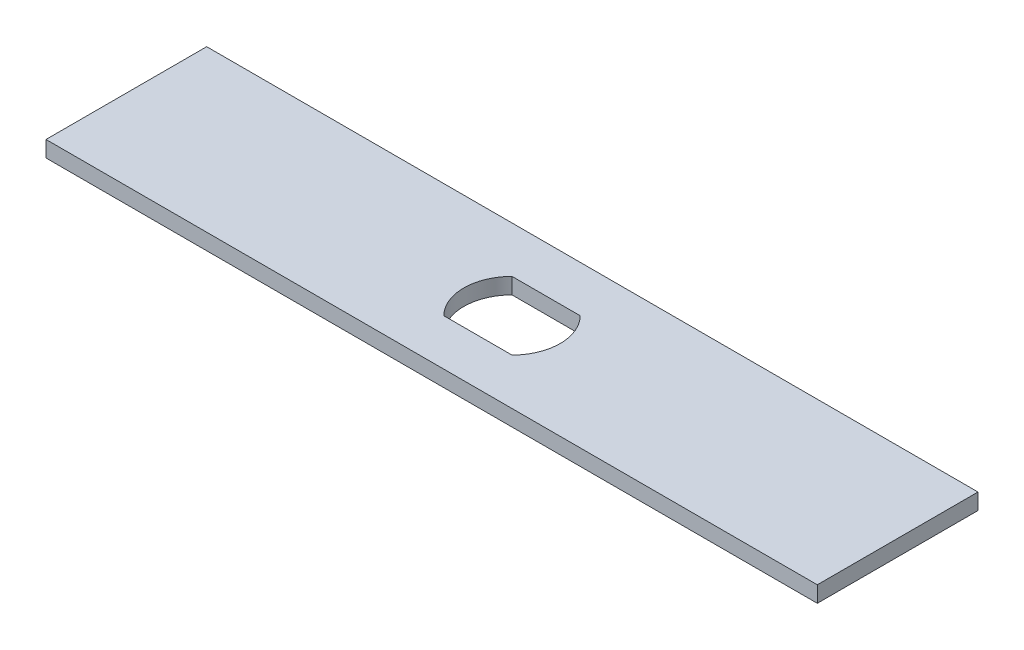
from build123d import *

# Parameters (mm, degrees)
SKETCH1_W           = 304.8
SKETCH1_H           = 63.5
SKETCH1_R           = 19.05
BOSS_EXTRUDE1_DEPTH = 6.35


with BuildPart() as part:
    # Sketch1 → Boss-Extrude1 (new body)
    # profile 1 of 3: a face of its own
    with BuildSketch(Plane(origin=(0, 0, 0), x_dir=(1, 0, 0), z_dir=(0, 1, 0))):
        with Locations((152.4, 31.75)):
            Rectangle(SKETCH1_W, SKETCH1_H)
        with Locations((152.4, 31.75)):
            Circle(SKETCH1_R, mode=Mode.SUBTRACT)
    # profile 2 of 3: a face of its own
    with BuildSketch(Plane(origin=(0, 0, 0), x_dir=(1, 0, 0), z_dir=(0, 1, 0))):
        with BuildLine():
            Line((138.929615818, 45.220384182), (165.870384182, 45.220384182))
            ThreePointArc((165.870384182, 45.220384182), (152.4, 50.8), (138.929615818, 45.220384182))
        make_face()
    # profile 3 of 3: a face of its own
    with BuildSketch(Plane(origin=(0, 0, 0), x_dir=(1, 0, 0), z_dir=(0, 1, 0))):
        with BuildLine():
            ThreePointArc((138.929615818, 18.279615818), (152.4, 12.7), (165.870384182, 18.279615818))
            Line((165.870384182, 18.279615818), (138.929615818, 18.279615818))
        make_face()
    extrude(amount=BOSS_EXTRUDE1_DEPTH)


solid = part.part
